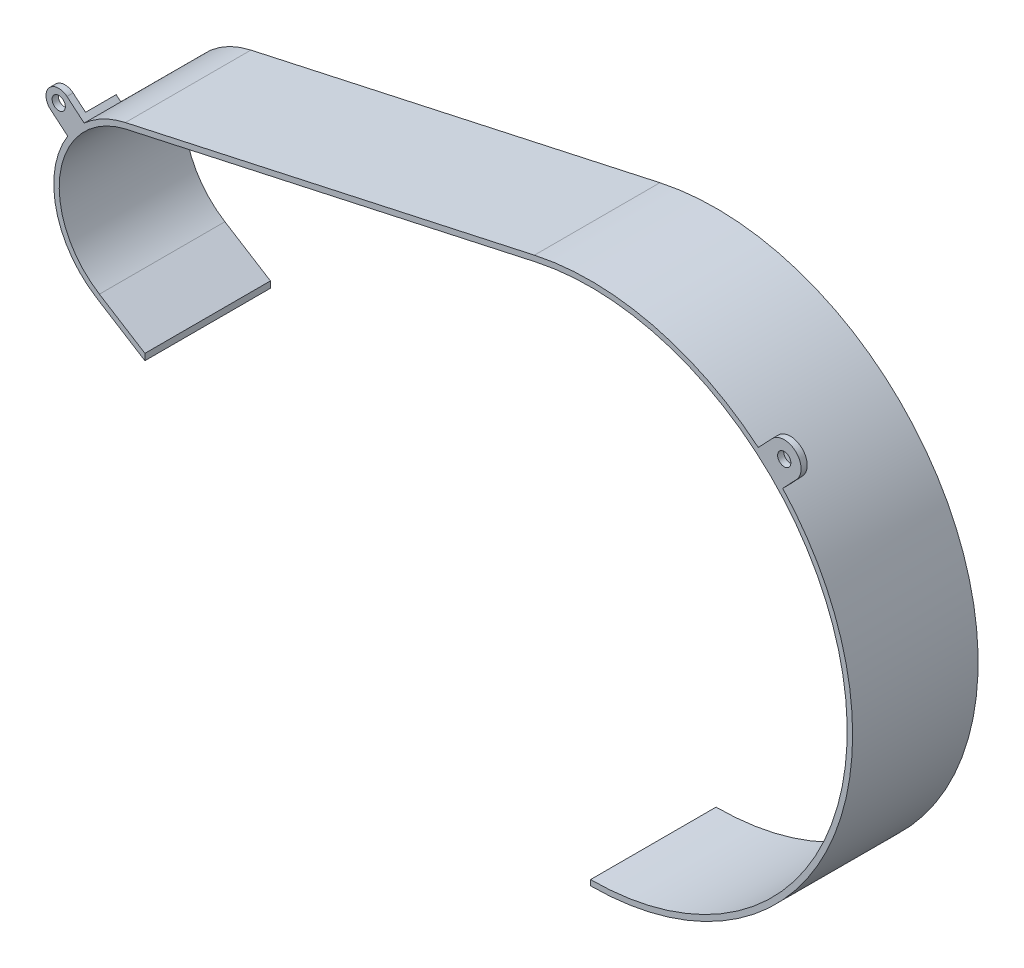
from build123d import *

# Parameters (mm, degrees)
BOSS_EXTRUDE2_DEPTH = 61.5
SKETCH2_W           = 218.385572997
SKETCH2_H           = 124.365016142
CUT_EXTRUDE1_DEPTH  = 386.947788671
BOSS_EXTRUDE3_START = -3
SKETCH3_R           = 3.25
BOSS_EXTRUDE3_DEPTH = 3
BOSS_EXTRUDE4_DEPTH = 15
BOSS_EXTRUDE5_START = -3
SKETCH6_R           = 3.25
BOSS_EXTRUDE5_DEPTH = 3


with BuildPart() as part:
    # Sketch1 → Boss-Extrude2 (new body)
    with BuildSketch(Plane.XY):
        with BuildLine():
            Line((190.19315477, 156.272365326), (-10.255131838, 112.342439713))
            ThreePointArc((-10.255131838, 112.342439713), (-44.696152674, 76.357425613), (-24.40062108, 30.869003423))
            Line((-24.40062108, 30.869003423), (149.50864928, -78.057208535))
            ThreePointArc((149.50864928, -78.057208535), (344.246573284, 8.828849476), (190.19315477, 156.272365326))
        make_face()
        with BuildLine():
            Line((-22.988653425, 33.123320912), (150.920616935, -75.802891046))
            ThreePointArc((150.920616935, -75.802891046), (341.625780863, 9.283873747), (190.762601122, 153.674033005))
            Line((190.762601122, 153.674033005), (-9.685685486, 109.744107392))
            ThreePointArc((-9.685685486, 109.744107392), (-42.075360253, 75.902401342), (-22.988653425, 33.123320912))
        make_face(mode=Mode.SUBTRACT)
    extrude(amount=BOSS_EXTRUDE2_DEPTH)

    # Sketch2 → Cut-Extrude1 (cut, through all)
    with BuildSketch(Plane.XY.offset(61.5)):
        with Locations((108.498359204, -35.464700489)):
            Rectangle(SKETCH2_W, SKETCH2_H)
    extrude(amount=-CUT_EXTRUDE1_DEPTH, mode=Mode.SUBTRACT)

    # Sketch3 → Boss-Extrude3 (add)
    with BuildSketch(Plane.XY.offset(61.5).offset(BOSS_EXTRUDE3_START)):
        with BuildLine():
            Line((-46.947493717, 99.519046948), (-38.537753643, 92.432744876))
            ThreePointArc((-38.537753643, 92.432744876), (-34.846524473, 97.495400572), (-30.483120585, 101.991661462))
            Line((-30.483120585, 101.991661462), (-38.892860659, 109.077963534))
            ThreePointArc((-38.892860659, 109.077963534), (-47.699635481, 108.32582177), (-46.947493717, 99.519046948))
        make_face()
        with Locations((-42.920177188, 104.298505241)):
            Circle(SKETCH3_R, mode=Mode.SUBTRACT)
    extrude(amount=BOSS_EXTRUDE3_DEPTH)

    # Sketch5 → Boss-Extrude4 (add)
    with BuildSketch(Plane(origin=(0, 0, 58.5), x_dir=(-1, 0, 0), z_dir=(0, 0, -1))):
        Polygon((32.777260566, 103.924773396), (40.831893624, 94.36585681), (38.537753643, 92.432744876), (30.483120585, 101.991661462), align=None)
    extrude(amount=BOSS_EXTRUDE4_DEPTH)

    # Sketch6 → Boss-Extrude5 (add)
    with BuildSketch(Plane.XY.offset(61.5).offset(BOSS_EXTRUDE5_START)):
        with BuildLine():
            Line((306.628435102, 136.596320118), (299.89851702, 129.498130928))
            ThreePointArc((299.89851702, 129.498130928), (306.067862447, 124.014335205), (311.872256697, 118.145617632))
            Line((311.872256697, 118.145617632), (318.602174779, 125.243806822))
            ThreePointArc((318.602174779, 125.243806822), (318.291561588, 136.906933309), (306.628435102, 136.596320118))
        make_face()
        with Locations((312.61530494, 130.92006347)):
            Circle(SKETCH6_R, mode=Mode.SUBTRACT)
    extrude(amount=BOSS_EXTRUDE5_DEPTH)


solid = part.part
